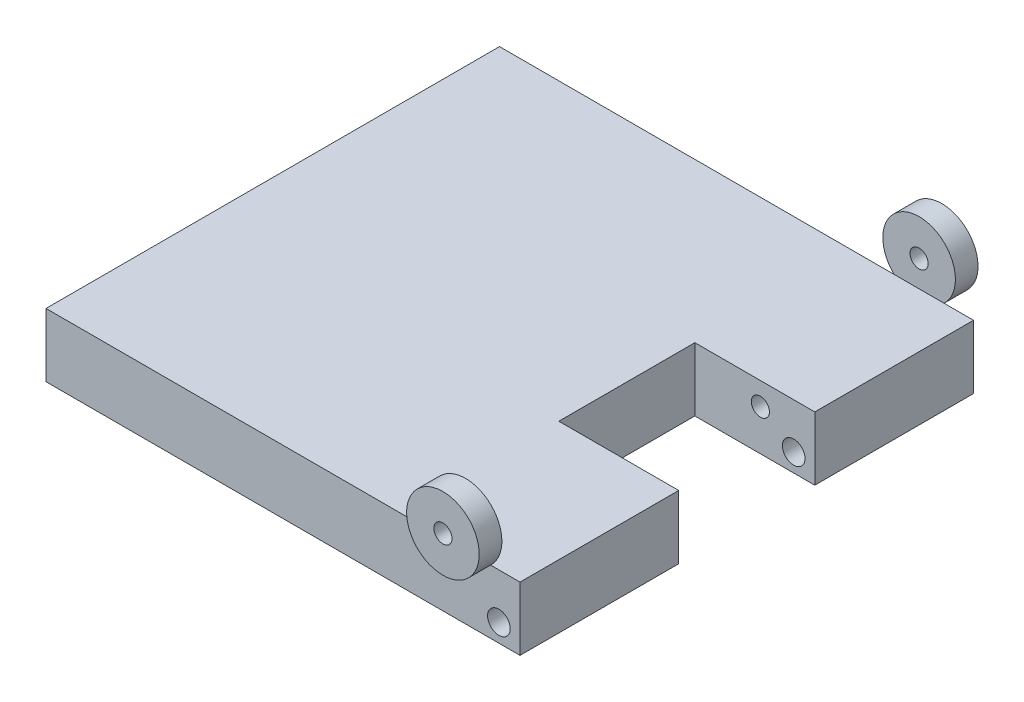
from build123d import *

# Parameters (mm, degrees)
SKETCH1_W           = 66.3702
SKETCH1_H           = 8.89
SKETCH1_R           = 1.5875
BOSS_EXTRUDE2_DEPTH = 63.5
CUT_EXTRUDE1_DEPTH  = 16.7894
SKETCH3_R           = 1.27
CUT_EXTRUDE2_DEPTH  = 12.7
CUT_EXTRUDE3_START  = -12.7
SKETCH4_R           = 1.27
CUT_EXTRUDE3_DEPTH  = 12.7
SKETCH5_R           = 5.08
SKETCH5_R_2         = 1.27
BOSS_EXTRUDE3_DEPTH = 3.175
BOSS_EXTRUDE4_START = 3.175
SKETCH6_R           = 5.08
SKETCH6_R_2         = 1.27
BOSS_EXTRUDE4_DEPTH = 3.175


with BuildPart() as part:
    # Sketch1 → Boss-Extrude2 (new body)
    with BuildSketch(Plane.XY):
        with Locations((-33.1851, 4.445)):
            Rectangle(SKETCH1_W, SKETCH1_H)
        with Locations((-2.954856457, 2.54)):
            Circle(SKETCH1_R, mode=Mode.SUBTRACT)
    extrude(amount=BOSS_EXTRUDE2_DEPTH)

    # Sketch2 → Cut-Extrude1 (cut)
    with BuildSketch(Plane(origin=(0, 0, 0), x_dir=(0, 0, -1), z_dir=(1, 0, 0))):
        Polygon((-31.75, 8.89), (-22.225, 8.89), (-22.225, 0), (-41.275, 0), (-41.275, 8.89), align=None)
    extrude(amount=-CUT_EXTRUDE1_DEPTH, mode=Mode.SUBTRACT)

    # Sketch3 → Cut-Extrude2 (cut)
    with BuildSketch(Plane(origin=(0, 0, 41.275), x_dir=(-1, 0, 0), z_dir=(0, 0, -1))):
        with Locations((7.62, 5.715)):
            Circle(SKETCH3_R)
    extrude(amount=-CUT_EXTRUDE2_DEPTH, mode=Mode.SUBTRACT)

    # Sketch4 → Cut-Extrude3 (cut)
    with BuildSketch(Plane.XY.offset(22.225).offset(CUT_EXTRUDE3_START)):
        with Locations(Location((-7.62, 5.715, 0), (0, 0, 180))):
            Circle(SKETCH4_R)
    extrude(amount=CUT_EXTRUDE3_DEPTH, mode=Mode.SUBTRACT)

    # Sketch5 → Boss-Extrude3 (add)
    with BuildSketch(Plane.XY.offset(63.5)):
        with Locations(Location((-7.62, 12.573, 0), (0, 0, 226.468847833))):
            Circle(SKETCH5_R)
        with Locations((-7.62, 12.573)):
            Circle(SKETCH5_R_2, mode=Mode.SUBTRACT)
    extrude(amount=BOSS_EXTRUDE3_DEPTH)

    # Sketch6 → Boss-Extrude4 (add)
    with BuildSketch(Plane(origin=(0, 0, 0), x_dir=(-1, 0, 0), z_dir=(0, 0, -1)).offset(BOSS_EXTRUDE4_START)):
        with Locations(Location((7.62, 12.573, 0), (0, 0, 313.531152167))):
            Circle(SKETCH6_R)
        with Locations(Location((7.62, 12.573, 0), (0, 0, 180))):
            Circle(SKETCH6_R_2, mode=Mode.SUBTRACT)
    extrude(amount=-BOSS_EXTRUDE4_DEPTH)


solid = part.part
